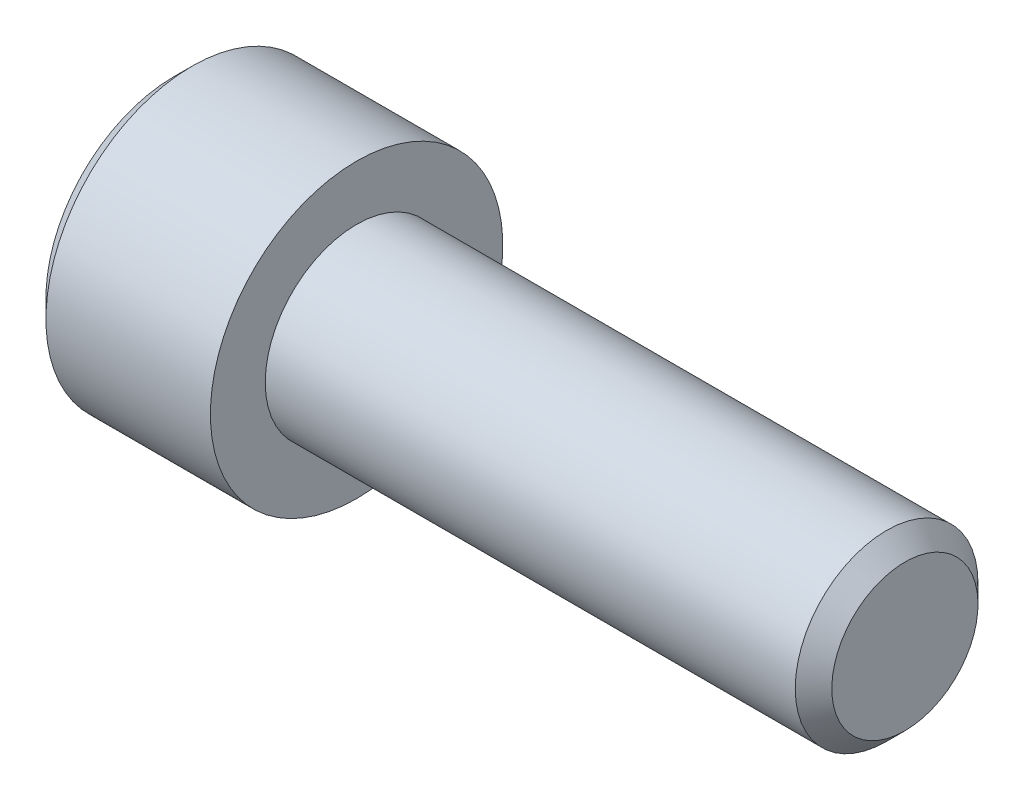
from build123d import *

# Parameters (mm, degrees)
CUT_EXTRUDE1_DEPTH = 5
CHAMFER1_SIZE      = 1


with BuildPart() as part:
    # Sketch1 → Revolve1 (revolve)
    with BuildSketch(Plane.XY, mode=Mode.PRIVATE) as revolve1_sk:
        Polygon((-10, 0), (-10, 8), (0, 8), (0, 5), (30, 5), (30, 0), align=None)
    revolve(revolve1_sk.sketch.rotate(Axis((30, 0, 0), (-1, 0, 0)), 180), axis=Axis((30, 0, 0), (-1, 0, 0)))

    # Sketch2 → Cut-Revolve1 (revolve, cut)
    with BuildSketch(Plane.XY, mode=Mode.PRIVATE) as cut_revolve1_sk:
        Polygon((-10, 0), (-10, 3.995), (-5, 3.995), (-3.929542976, 0), align=None)
    revolve(cut_revolve1_sk.sketch.rotate(Axis((-3.929542976, 0, 0), (-1, 0, 0)), 180), axis=Axis((-3.929542976, 0, 0), (-1, 0, 0)), mode=Mode.SUBTRACT)

    # Sketch3 → Cut-Extrude1 (cut)
    with BuildSketch(Plane(origin=(-10, 0, 0), x_dir=(0, 0, -1), z_dir=(1, 0, 0))):
        Polygon((0, 4.618802154), (-4, 2.309401077), (-4, -2.309401077), (0, -4.618802154), (4, -2.309401077), (4, 2.309401077), align=None)
    extrude(amount=CUT_EXTRUDE1_DEPTH, mode=Mode.SUBTRACT)

    # Chamfer1
    chamfer1_edges = [part.edges().sort_by_distance(p)[0] for p in [
        (30, 5, 0),
        (-10, 8, 0),
    ]]
    chamfer(chamfer1_edges, length=CHAMFER1_SIZE)


solid = part.part
